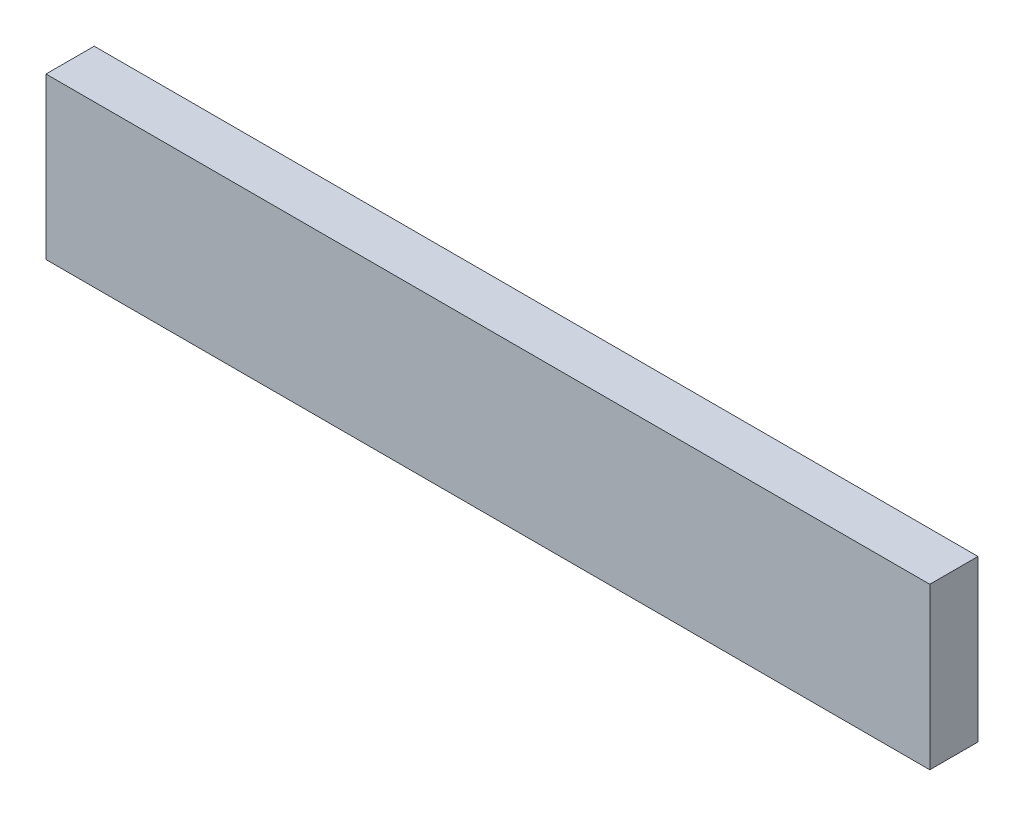
from build123d import *

# Parameters (mm, degrees)
SKETCH1_W           = 55
SKETCH1_H           = 10
BOSS_EXTRUDE1_DEPTH = 3


with BuildPart() as part:
    # Sketch1 → Boss-Extrude1 (new body)
    with BuildSketch(Plane.XY):
        with Locations((27.5, 5)):
            Rectangle(SKETCH1_W, SKETCH1_H)
    extrude(amount=BOSS_EXTRUDE1_DEPTH)


solid = part.part
